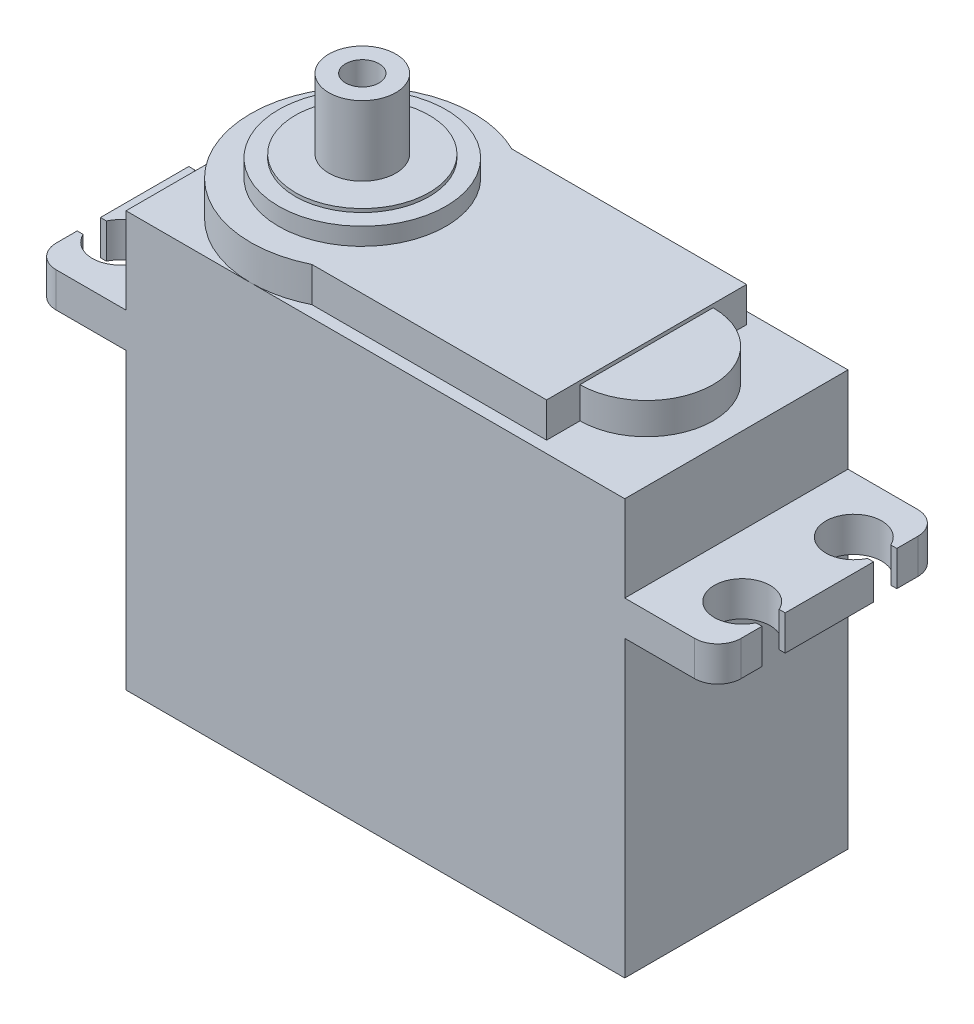
from build123d import *

# Parameters (mm, degrees)
SKETCH_1_W             = 42.9
SKETCH_1_H             = 19.2
EXTRUDE_1_DEPTH        = 35.7
EXTRUDE_3_DEPTH        = 3
SKETCH_5_R             = 7.2
EXTRUDE_4_DEPTH        = 1.5
SKETCH_6_R             = 5.76
EXTRUDE_5_DEPTH        = 0.3
CUT_EXTRUDE_START      = -0.3
CUT_EXTRUDE_3_DEPTH    = 0.3
EXTRUDE_6_DEPTH        = 8
FILLET_1_R             = 2
FILLET_2_R             = 2
CUT_EXTRUDE_4_DEPTH    = 62.321611199
FILLET_1_OF_MIRROR_2_R = 2
FILLET_2_OF_MIRROR_2_R = 2
SKETCH_10_R            = 2.88
EXTRUDE_7_DEPTH        = 6
SKETCH_11_R            = 1.44
CUT_EXTRUDE_5_DEPTH    = 6


with BuildPart() as part:
    # Эскиз1 → Бобышка-Вытянуть1 (new body)
    with BuildSketch(Plane(origin=(0, 0, 0), x_dir=(1, 0, 0), z_dir=(0, 1, 0))):
        with Locations((21.45, 9.6)):
            Rectangle(SKETCH_1_W, SKETCH_1_H)
    extrude(amount=EXTRUDE_1_DEPTH)

    # Эскиз2 → Бобышка-Вытянуть3 (add)
    with BuildSketch(Plane(origin=(0, 35.7, 0), x_dir=(1, 0, 0), z_dir=(0, 1, 0))):
        with BuildLine():
            Line((14.991145802, 1), (35.175, 1))
            Line((35.175, 1), (35.175, 3.875))
            ThreePointArc((35.175, 3.875), (40.9, 9.6), (35.175, 15.325))
            Line((35.175, 15.325), (35.175, 18.2))
            Line((35.175, 18.2), (14.991145802, 18.2))
            ThreePointArc((14.991145802, 18.2), (1.125, 9.6), (14.991145802, 1))
        make_face()
    extrude(amount=EXTRUDE_3_DEPTH)

    # Эскиз5 → Бобышка-Вытянуть4 (add)
    with BuildSketch(Plane(origin=(0, 38.7, 0), x_dir=(1, 0, 0), z_dir=(0, 1, 0))):
        with Locations((10.725, 9.6)):
            Circle(SKETCH_5_R)
    extrude(amount=EXTRUDE_4_DEPTH)

    # Эскиз6 → Бобышка-Вытянуть5 (add)
    with BuildSketch(Plane(origin=(0, 40.2, 0), x_dir=(1, 0, 0), z_dir=(0, 1, 0))):
        with Locations((10.725, 9.6)):
            Circle(SKETCH_6_R)
    extrude(amount=EXTRUDE_5_DEPTH)

    # Эскиз4 → Вырез-Вытянуть3 (cut)
    with BuildSketch(Plane(origin=(0, 38.7, 0), x_dir=(1, 0, 0), z_dir=(0, 1, 0)).offset(CUT_EXTRUDE_START)):
        with BuildLine():
            Line((35.175, 15.325), (35.175, 3.875))
            ThreePointArc((35.175, 3.875), (40.9, 9.6), (35.175, 15.325))
        make_face()
    extrude(amount=CUT_EXTRUDE_3_DEPTH, mode=Mode.SUBTRACT)

    # Эскиз8 → Бобышка-Вытянуть6 (add)
    with BuildSketch(Plane(origin=(42.9, 0, 0), x_dir=(0, 0, -1), z_dir=(1, 0, 0))):
        Polygon((19.2, 26.8), (19.2, 28.3), (0, 28.3), (0, 25.3), (19.2, 25.3), align=None)
    extrude_6 = extrude(amount=EXTRUDE_6_DEPTH)

    # Скругление1
    fillet_1_edges = [part.edges().sort_by_distance(p)[0] for p in [
        (50.9, 26.8, 0),
    ]]
    fillet(fillet_1_edges, radius=FILLET_1_R)

    # Скругление2
    fillet_2_edges = [part.edges().sort_by_distance(p)[0] for p in [
        (50.9, 26.8, -19.2),
    ]]
    fillet(fillet_2_edges, radius=FILLET_2_R)

    # Эскиз9 → Вырез-Вытянуть4 (cut, through all)
    with BuildSketch(Plane(origin=(0, 28.3, 0), x_dir=(1, 0, 0), z_dir=(0, 1, 0))):
        with BuildLine():
            Line((50.381742423, 5.8), (50.9, 5.8))
            Line((50.9, 5.8), (50.9, 3.8))
            Line((50.9, 3.8), (50.381742423, 3.8))
            ThreePointArc((50.381742423, 3.8), (45.8, 4.8), (50.381742423, 5.8))
        make_face()
        with BuildLine():
            Line((50.381742423, 15.4), (50.9, 15.4))
            Line((50.9, 15.4), (50.9, 13.4))
            Line((50.9, 13.4), (50.381742423, 13.4))
            ThreePointArc((50.381742423, 13.4), (45.8, 14.4), (50.381742423, 15.4))
        make_face()
    cut_extrude_4 = extrude(amount=-CUT_EXTRUDE_4_DEPTH, mode=Mode.SUBTRACT)

    # Зеркальное отражение2: Бобышка-Вытянуть6, Вырез-Вытянуть4 across plane
    add(extrude_6.mirror(Plane(origin=(21.45, 0, 0), x_dir=(0, 0, 1), z_dir=(1, 0, 0))))
    add(cut_extrude_4.mirror(Plane(origin=(21.45, 0, 0), x_dir=(0, 0, 1), z_dir=(1, 0, 0))), mode=Mode.SUBTRACT)

    # Скругление1 of Зеркальное отражение2
    fillet_1_of_mirror_2_edges = [part.edges().sort_by_distance(p)[0] for p in [
        (-8, 26.8, 0),
    ]]
    fillet(fillet_1_of_mirror_2_edges, radius=FILLET_1_OF_MIRROR_2_R)

    # Скругление2 of Зеркальное отражение2
    fillet_2_of_mirror_2_edges = [part.edges().sort_by_distance(p)[0] for p in [
        (-8, 26.8, -19.2),
    ]]
    fillet(fillet_2_of_mirror_2_edges, radius=FILLET_2_OF_MIRROR_2_R)

    # Эскиз10 → Бобышка-Вытянуть7 (add)
    with BuildSketch(Plane(origin=(0, 40.5, 0), x_dir=(1, 0, 0), z_dir=(0, 1, 0))):
        with Locations((10.725, 9.6)):
            Circle(SKETCH_10_R)
    extrude(amount=EXTRUDE_7_DEPTH)

    # Эскиз11 → Вырез-Вытянуть5 (cut)
    with BuildSketch(Plane(origin=(0, 46.5, 0), x_dir=(1, 0, 0), z_dir=(0, 1, 0))):
        with Locations((10.725, 9.6)):
            Circle(SKETCH_11_R)
    extrude(amount=-CUT_EXTRUDE_5_DEPTH, mode=Mode.SUBTRACT)


solid = part.part
